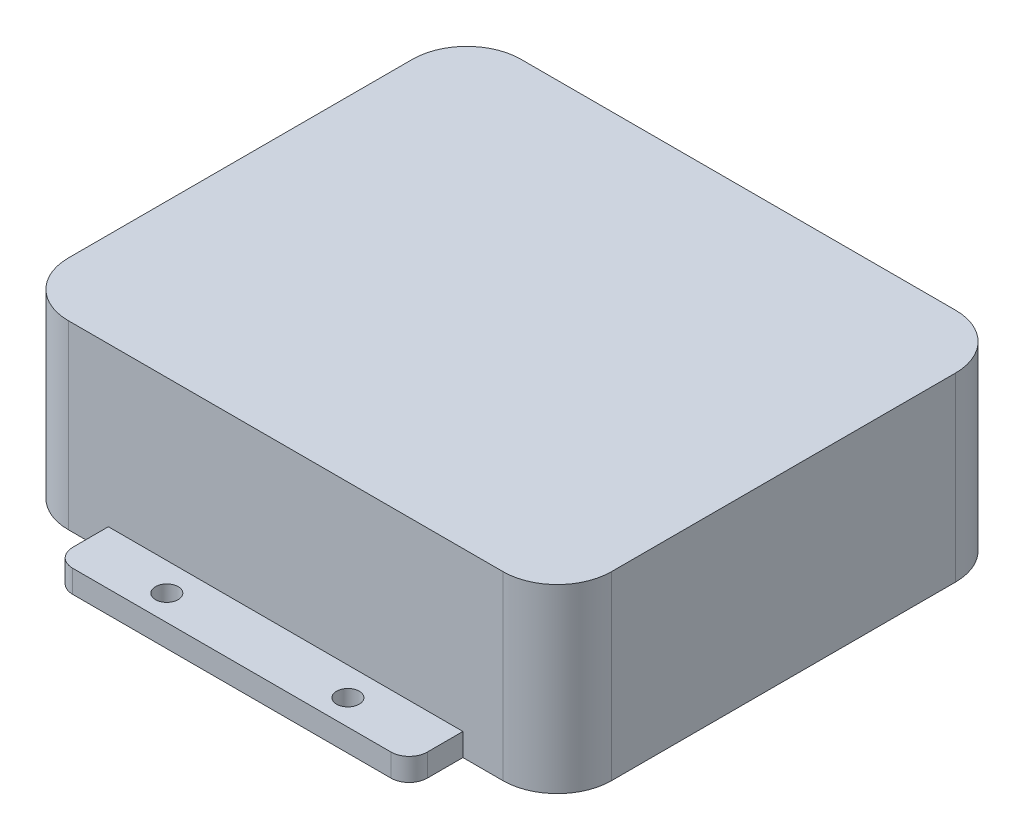
from build123d import *

# Parameters (mm, degrees)
BOSS_EXTRUDE1_DEPTH = 25.4
SKETCH2_R           = 1.5875
BOSS_EXTRUDE2_DEPTH = 3.175


with BuildPart() as part:
    # Sketch1 → Boss-Extrude1 (new body)
    with BuildSketch(Plane(origin=(0, 0, 0), x_dir=(1, 0, 0), z_dir=(0, 1, 0))):
        with BuildLine():
            Line((-30.48, -31.75), (30.48, -31.75))
            ThreePointArc((30.48, -31.75), (35.868153673, -29.518153673), (38.1, -24.13))
            Line((38.1, -24.13), (38.1, 24.13))
            ThreePointArc((38.1, 24.13), (35.868153673, 29.518153673), (30.48, 31.75))
            Line((30.48, 31.75), (-30.48, 31.75))
            ThreePointArc((-30.48, 31.75), (-35.868153673, 29.518153673), (-38.1, 24.13))
            Line((-38.1, 24.13), (-38.1, -24.13))
            ThreePointArc((-38.1, -24.13), (-35.868153673, -29.518153673), (-30.48, -31.75))
        make_face()
    extrude(amount=BOSS_EXTRUDE1_DEPTH)

    # Sketch2 → Boss-Extrude2 (add)
    # profile 1 of 2: a face of its own
    with BuildSketch(Plane(origin=(0, 0, 0), x_dir=(1, 0, 0), z_dir=(0, 1, 0))):
        with BuildLine():
            Line((-24.869490834, -31.75), (24.869490834, -31.75))
            Line((24.869490834, -31.75), (24.869490834, -36.754911613))
            ThreePointArc((24.869490834, -36.754911613), (24.125542058, -38.550962837), (22.329490834, -39.294911613))
            Line((22.329490834, -39.294911613), (-22.329490834, -39.294911613))
            ThreePointArc((-22.329490834, -39.294911613), (-24.125542058, -38.550962837), (-24.869490834, -36.754911613))
            Line((-24.869490834, -36.754911613), (-24.869490834, -31.75))
        make_face()
        with Locations(Location((12.7, -35.71875, 0), (0, 0, 270))):
            Circle(SKETCH2_R, mode=Mode.SUBTRACT)
        with Locations(Location((-12.7, -35.71875, 0), (0, 0, 90))):
            Circle(SKETCH2_R, mode=Mode.SUBTRACT)
    # profile 2 of 2: a face of its own
    with BuildSketch(Plane(origin=(0, 0, 0), x_dir=(1, 0, 0), z_dir=(0, 1, 0))):
        with BuildLine():
            Line((-24.869490834, 31.75), (-24.869490834, 36.754911613))
            ThreePointArc((-24.869490834, 36.754911613), (-24.125542058, 38.550962837), (-22.329490834, 39.294911613))
            Line((-22.329490834, 39.294911613), (22.329490834, 39.294911613))
            ThreePointArc((22.329490834, 39.294911613), (24.125542058, 38.550962837), (24.869490834, 36.754911613))
            Line((24.869490834, 36.754911613), (24.869490834, 31.75))
            Line((24.869490834, 31.75), (-24.869490834, 31.75))
        make_face()
        with Locations(Location((12.7, 35.71875, 0), (0, 0, 90))):
            Circle(SKETCH2_R, mode=Mode.SUBTRACT)
        with Locations(Location((-12.7, 35.71875, 0), (0, 0, 270))):
            Circle(SKETCH2_R, mode=Mode.SUBTRACT)
    extrude(amount=BOSS_EXTRUDE2_DEPTH)


solid = part.part
